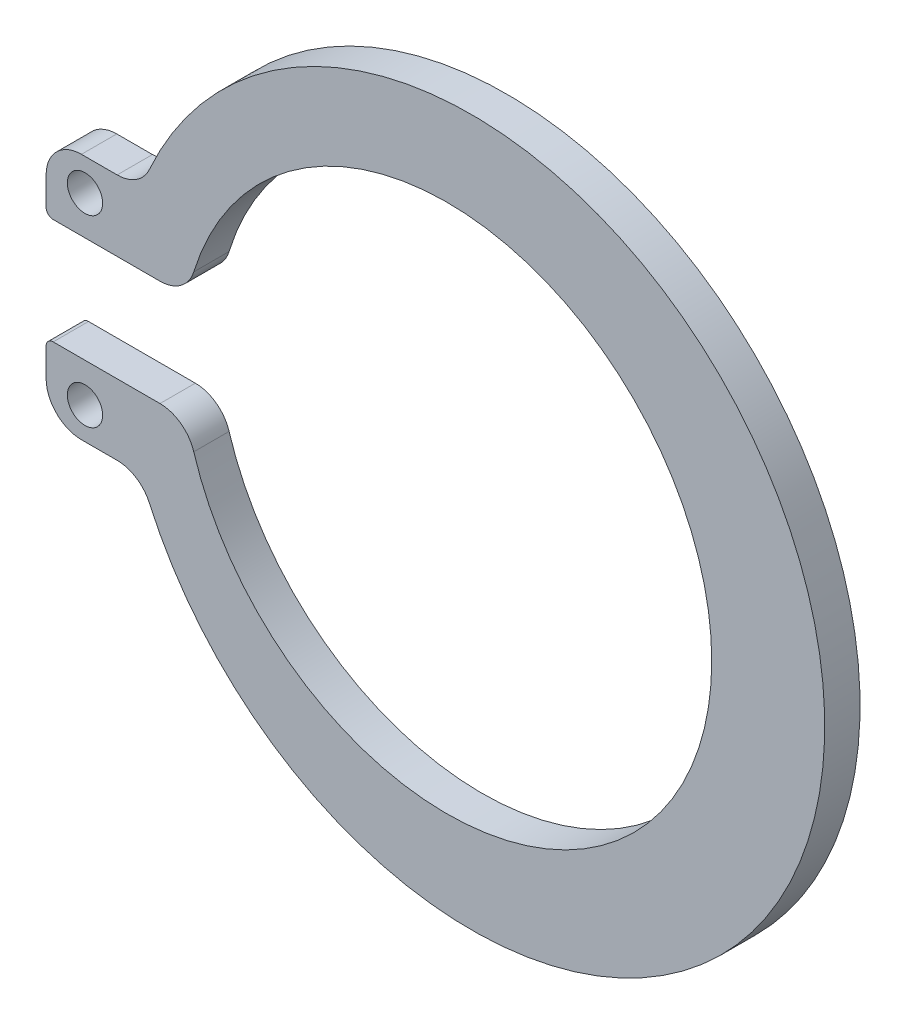
from build123d import *

# Parameters (mm, degrees)
BOSS_EXTRUDE1_DEPTH = 0.5
FILLET1_R           = 0.5
FILLET2_R           = 0.1
CUT_EXTRUDE1_REACH  = 9.579
SKETCH2_R           = 0.25


with BuildPart() as part:
    # Sketch1 → Boss-Extrude1 (new body)
    with BuildSketch(Plane.XY):
        with BuildLine():
            Line((-3.674234614, 0.75), (-5.674234614, 0.75))
            Line((-5.674234614, 0.75), (-5.674234614, 1.75))
            Line((-5.674234614, 1.75), (-4.333748499, 1.75))
            ThreePointArc((-4.333748499, 1.75), (5.35, 0), (-4.333748499, -1.75))
            Line((-4.333748499, -1.75), (-5.674234614, -1.75))
            Line((-5.674234614, -1.75), (-5.674234614, -0.75))
            Line((-5.674234614, -0.75), (-3.674234614, -0.75))
            ThreePointArc((-3.674234614, -0.75), (3.75, 0), (-3.674234614, 0.75))
        make_face()
    extrude(amount=BOSS_EXTRUDE1_DEPTH)

    # Fillet1
    fillet1_edges = [part.edges().sort_by_distance(p)[0] for p in [
        (-5.674234614, 1.75, 0.25),
        (-4.333748499, 1.75, 0.25),
        (-4.333748499, -1.75, 0.25),
        (-5.674234614, -1.75, 0.25),
        (-3.674234614, -0.75, 0.25),
        (-3.674234614, 0.75, 0.25),
    ]]
    fillet(fillet1_edges, radius=FILLET1_R)

    # Fillet2
    fillet2_edges = [part.edges().sort_by_distance(p)[0] for p in [
        (-5.674234614, -0.75, 0.25),
        (-5.674234614, 0.75, 0.25),
    ]]
    fillet(fillet2_edges, radius=FILLET2_R)

    # Sketch2 → Cut-Extrude1 (cut, up to next)
    with BuildSketch(Plane.XY.offset(0.5), mode=Mode.PRIVATE) as cut_extrude1_sk1:
        with Locations((-5.124234614, 1.3)):
            Circle(SKETCH2_R)
    cut_extrude1_tool1 = extrude(cut_extrude1_sk1.sketch, amount=-CUT_EXTRUDE1_REACH, mode=Mode.PRIVATE) & part.part
    # Sketch2 → Cut-Extrude1 (cut, up to next)
    with BuildSketch(Plane.XY.offset(0.5), mode=Mode.PRIVATE) as cut_extrude1_sk2:
        with Locations((-5.124234614, -1.3)):
            Circle(SKETCH2_R)
    cut_extrude1_tool2 = extrude(cut_extrude1_sk2.sketch, amount=-CUT_EXTRUDE1_REACH, mode=Mode.PRIVATE) & part.part
    add(cut_extrude1_tool1.solids().sort_by_distance((-5.124235, 1.3, 0.5))[0], mode=Mode.SUBTRACT)
    add(cut_extrude1_tool2.solids().sort_by_distance((-5.124235, -1.3, 0.5))[0], mode=Mode.SUBTRACT)


solid = part.part
